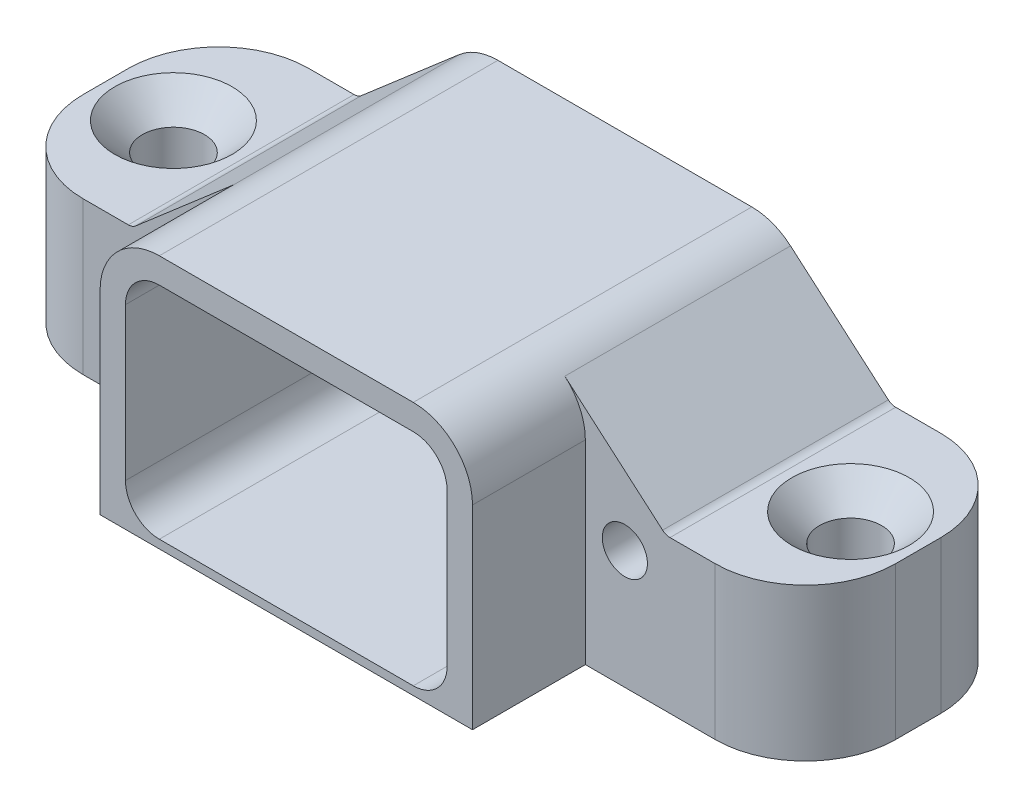
from build123d import *

# Parameters (mm, degrees)
SKETCH1_R                                       = 2
BOSS_EXTRUDE1_DEPTH                             = 20
CSK_FOR_M5_FLAT_HEAD_MACHINE_SCREW1_D           = 5.5
CSK_FOR_M5_FLAT_HEAD_MACHINE_SCREW1_CSINK_D     = 10.4
CSK_FOR_M5_FLAT_HEAD_MACHINE_SCREW1_CSINK_ANGLE = 90
BOSS_EXTRUDE2_DEPTH                             = 10
FILLET3_R                                       = 8


with BuildPart() as part:
    # Sketch1 → Boss-Extrude1 (new body)
    with BuildSketch(Plane.XY):
        with BuildLine():
            Line((0, -9.75), (-11.25, -9.75))
            ThreePointArc((-11.25, -9.75), (-13.371320344, -8.871320344), (-14.25, -6.75))
            Line((-14.25, -6.75), (-14.25, 6.75))
            ThreePointArc((-14.25, 6.75), (-13.371320344, 8.871320344), (-11.25, 9.75))
            Line((-11.25, 9.75), (0, 9.75))
            Line((0, 9.75), (0, 12))
            Line((0, 12), (-11.25, 12))
            ThreePointArc((-11.25, 12), (-13.080137287, 11.670680594), (-14.680674679, 10.724037147))
            Line((-14.680674679, 10.724037147), (-23.346538156, 3.243040543))
            ThreePointArc((-23.346538156, 3.243040543), (-23.651402422, 3.062727506), (-24, 3))
            Line((-24, 3), (-36, 3))
            Line((-36, 3), (-36, -10.5))
            Line((-36, -10.5), (0, -10.5))
            Line((0, -10.5), (0, -9.75))
        make_face()
        with Locations((-20, 0)):
            Circle(SKETCH1_R, mode=Mode.SUBTRACT)
    extrude(amount=BOSS_EXTRUDE1_DEPTH)

    # CSK for M5 Flat Head Machine Screw1 (through all)
    with Locations(Plane(origin=(0, 3, 0), x_dir=(1, 0, 0), z_dir=(0, 1, 0))):
        with Locations((-30, -10)):
            CounterSinkHole(CSK_FOR_M5_FLAT_HEAD_MACHINE_SCREW1_D / 2, CSK_FOR_M5_FLAT_HEAD_MACHINE_SCREW1_CSINK_D / 2, counter_sink_angle=CSK_FOR_M5_FLAT_HEAD_MACHINE_SCREW1_CSINK_ANGLE)

    # Sketch7 → Boss-Extrude2 (add)
    with BuildSketch(Plane.XY.offset(20)):
        with BuildLine():
            Line((0, 9.75), (0, 12))
            Line((0, 12), (-11.25, 12))
            ThreePointArc((-11.25, 12), (-13.080137287, 11.670680594), (-14.680674679, 10.724037147))
            ThreePointArc((-14.680674679, 10.724037147), (-16.023549102, 8.93534413), (-16.5, 6.75))
            Line((-16.5, 6.75), (-16.5, -10.5))
            Line((-16.5, -10.5), (0, -10.5))
            Line((0, -10.5), (0, -9.75))
            Line((0, -9.75), (-11.25, -9.75))
            ThreePointArc((-11.25, -9.75), (-13.371320344, -8.871320344), (-14.25, -6.75))
            Line((-14.25, -6.75), (-14.25, 6.75))
            ThreePointArc((-14.25, 6.75), (-13.371320344, 8.871320344), (-11.25, 9.75))
            Line((-11.25, 9.75), (0, 9.75))
        make_face()
    extrude(amount=BOSS_EXTRUDE2_DEPTH)

    # Fillet3
    fillet3_edges = [part.edges().sort_by_distance(p)[0] for p in [
        (-36, -3.75, 20),
        (-36, -3.75, 0),
    ]]
    fillet(fillet3_edges, radius=FILLET3_R)

    # Mirror1: part across plane


with BuildPart() as part_1:
    add(part.part)
    add(part.part.mirror(Plane(origin=(0, 0, 0), x_dir=(0, 0, 1), z_dir=(1, 0, 0))))


solid = part_1.part
